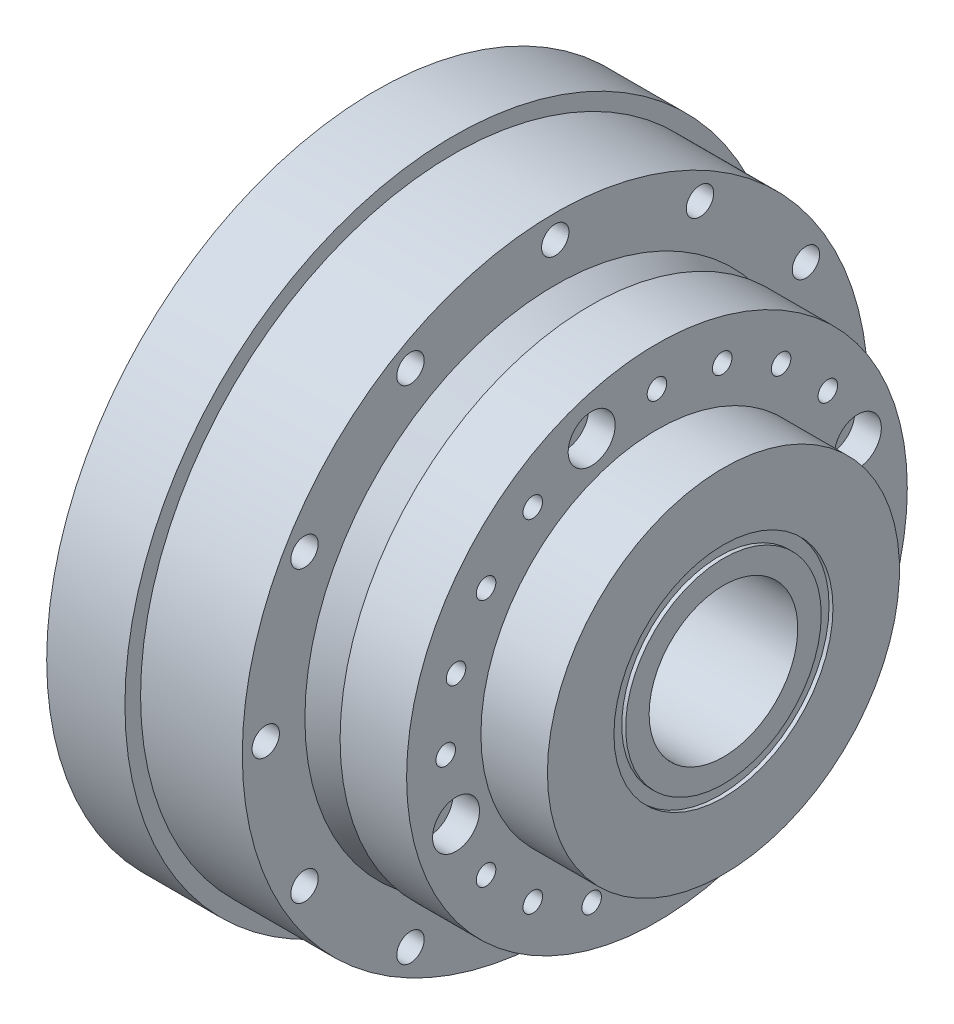
from build123d import *

# Parameters (mm, degrees)
CUT_EXTRUDE_1_REACH      = 76.218
SKETCH_5_R               = 1.75
PATTERN_CIRCULAR_2_COUNT = 12
SKETCH_9_R               = 22.5
SKETCH_9_R_2             = 10
EXTRUDE_1_DEPTH          = 5.5
PATTERN_CIRCULAR_4_COUNT = 3
SKETCH_12_R              = 14
SKETCH_12_R_2            = 12.5
CUT_EXTRUDE_4_DEPTH      = 0.5
CUT_EXTRUDE_START        = -0.5
SKETCH_14_R              = 14
SKETCH_14_R_2            = 12.5
CUT_EXTRUDE_5_DEPTH      = 0.5
PATTERN_CIRCULAR_5_COUNT = 4
PATTERN_CIRCULAR_5_ANGLE = 54
PATTERN_CIRCULAR_7_COUNT = 4


with BuildPart() as part:
    # 草图1 → 旋转1 (revolve)
    with BuildSketch(Plane.XY):
        Polygon((0, 9.5), (0, 12.5), (12, 12.5), (12, 42), (22, 42), (22, 40), (35, 40), (35, 32), (39.5, 29.401923789), (39.5, 32), (48, 32), (48, 22.5), (56.5, 22.5), (56.5, 9.5), align=None)
    revolve(axis=Axis((-65.200779727, 0, 0), (1, 0, 0)))

    # 草图5 → 切除-拉伸1 (cut, up to next)
    with BuildSketch(Plane.ZY.offset(-12), mode=Mode.PRIVATE) as cut_extrude_1_sk1:
        with Locations((0, 37)):
            Circle(SKETCH_5_R)
    cut_extrude_1_tool1 = extrude(cut_extrude_1_sk1.sketch, amount=-CUT_EXTRUDE_1_REACH, mode=Mode.PRIVATE) & part.part
    cut_extrude_1 = cut_extrude_1_tool1.solids().sort_by_distance((12, 37, 0))[0]
    add(cut_extrude_1, mode=Mode.SUBTRACT)

    # 阵列(圆周)2: 切除-拉伸1 ×12 about axis
    pattern_circular_2_axis = Axis((56.5, 0, 0), (-1, 0, 0))
    for i in range(1, PATTERN_CIRCULAR_2_COUNT):
        add(cut_extrude_1.rotate(pattern_circular_2_axis, i * 360 / PATTERN_CIRCULAR_2_COUNT), mode=Mode.SUBTRACT)

    # 草图9 → 凸台-拉伸1 (add)
    with BuildSketch(Plane.ZY.offset(-12)):
        Circle(SKETCH_9_R)
        Circle(SKETCH_9_R_2, mode=Mode.SUBTRACT)
    extrude(amount=EXTRUDE_1_DEPTH)

    # 草图10 → M3 螺纹孔3 (revolve, cut)
    with BuildSketch(Plane(origin=(2.5, 12.5, 0), x_dir=(0, 0, 1), z_dir=(1, 0, 0))):
        Polygon((0, 0), (0, 7.251075774), (1.25, 6.5), (1.25, 0), align=None)
    hole_wizard_m3_3 = revolve(axis=Axis((2.5, 18.85, 0), (0, -1, 0)), mode=Mode.SUBTRACT)

    # 阵列(圆周)4: M3 螺纹孔3 ×3 about axis
    pattern_circular_4_axis = Axis((56.5, 0, 0), (-1, 0, 0))
    for i in range(1, PATTERN_CIRCULAR_4_COUNT):
        add(hole_wizard_m3_3.rotate(pattern_circular_4_axis, i * 360 / PATTERN_CIRCULAR_4_COUNT), mode=Mode.SUBTRACT)

    # 草图12 → 切除-拉伸4 (cut)
    with BuildSketch(Plane(origin=(56.5, 0, 0), x_dir=(0, 0, -1), z_dir=(1, 0, 0))):
        Circle(SKETCH_12_R)
        Circle(SKETCH_12_R_2, mode=Mode.SUBTRACT)
    extrude(amount=-CUT_EXTRUDE_4_DEPTH, mode=Mode.SUBTRACT)

    # 草图14 → 切除-拉伸5 (cut)
    with BuildSketch(Plane.ZY.offset(-6.5).offset(CUT_EXTRUDE_START)):
        Circle(SKETCH_14_R)
        Circle(SKETCH_14_R_2, mode=Mode.SUBTRACT)
    extrude(amount=CUT_EXTRUDE_5_DEPTH, mode=Mode.SUBTRACT)

    # 草图15 → M3 螺纹孔4 (revolve, cut)
    with BuildSketch(Plane(origin=(48, 27, 0), x_dir=(0, 0, -1), z_dir=(0, 1, 0))):
        Polygon((0, 0), (0, 12.751075774), (1.25, 12), (1.25, 0), align=None)
    hole_wizard_m3_4 = revolve(axis=Axis((54.35, 27, 0), (-1, 0, 0)), mode=Mode.SUBTRACT)

    # 阵列(圆周)5: M3 螺纹孔4 ×4 about axis
    pattern_circular_5_axis = Axis((56.5, 0, 0), (-1, 0, 0))
    for i in range(1, PATTERN_CIRCULAR_5_COUNT):
        add(hole_wizard_m3_4.rotate(pattern_circular_5_axis, i * PATTERN_CIRCULAR_5_ANGLE / (PATTERN_CIRCULAR_5_COUNT - 1)), mode=Mode.SUBTRACT)

    # 阵列(圆周)6 copy 1 sketch → 阵列(圆周)6 copy 1 (revolve, cut)
    with BuildSketch(Plane(origin=(48, -8.343458848, -25.67852594), x_dir=(0, -0.9510565162951534, 0.309016994374948), z_dir=(0, -0.309016994374948, -0.9510565162951534))):
        Polygon((0, 0), (0, 12.751075774), (1.25, 12), (1.25, 0), align=None)
    revolve(axis=Axis((54.35, -8.343458848, -25.67852594), (-1, 0, 0)), mode=Mode.SUBTRACT)

    # 阵列(圆周)6 copy 2 sketch → 阵列(圆周)6 copy 2 (revolve, cut)
    with BuildSketch(Plane(origin=(48, -25.67852594, 8.343458848), x_dir=(0, 0.30901699437494795, 0.9510565162951534), z_dir=(0, -0.9510565162951534, 0.30901699437494795))):
        Polygon((0, 0), (0, 12.751075774), (1.25, 12), (1.25, 0), align=None)
    revolve(axis=Axis((54.35, -25.67852594, 8.343458848), (-1, 0, 0)), mode=Mode.SUBTRACT)

    # 阵列(圆周)6 copy 3 sketch → 阵列(圆周)6 copy 3 (revolve, cut)
    with BuildSketch(Plane(origin=(48, 8.343458848, 25.67852594), x_dir=(0, 0.9510565162951535, -0.3090169943749479), z_dir=(0, 0.3090169943749479, 0.9510565162951535))):
        Polygon((0, 0), (0, 12.751075774), (1.25, 12), (1.25, 0), align=None)
    revolve(axis=Axis((54.35, 8.343458848, 25.67852594), (-1, 0, 0)), mode=Mode.SUBTRACT)

    # 阵列(圆周)6 copy 4 sketch → 阵列(圆周)6 copy 4 (revolve, cut)
    with BuildSketch(Plane(origin=(48, -15.870201812, -21.843458848), x_dir=(0, -0.8090169943749467, 0.5877852522924741), z_dir=(0, -0.5877852522924741, -0.8090169943749467))):
        Polygon((0, 0), (0, 12.751075774), (1.25, 12), (1.25, 0), align=None)
    revolve(axis=Axis((54.35, -15.870201812, -21.843458848), (-1, 0, 0)), mode=Mode.SUBTRACT)

    # 阵列(圆周)6 copy 5 sketch → 阵列(圆周)6 copy 5 (revolve, cut)
    with BuildSketch(Plane(origin=(48, -21.843458848, 15.870201812), x_dir=(0, 0.587785252292474, 0.8090169943749468), z_dir=(0, -0.8090169943749468, 0.587785252292474))):
        Polygon((0, 0), (0, 12.751075774), (1.25, 12), (1.25, 0), align=None)
    revolve(axis=Axis((54.35, -21.843458848, 15.870201812), (-1, 0, 0)), mode=Mode.SUBTRACT)

    # 阵列(圆周)6 copy 6 sketch → 阵列(圆周)6 copy 6 (revolve, cut)
    with BuildSketch(Plane(origin=(48, 15.870201812, 21.843458848), x_dir=(0, 0.8090169943749468, -0.587785252292474), z_dir=(0, 0.587785252292474, 0.8090169943749468))):
        Polygon((0, 0), (0, 12.751075774), (1.25, 12), (1.25, 0), align=None)
    revolve(axis=Axis((54.35, 15.870201812, 21.843458848), (-1, 0, 0)), mode=Mode.SUBTRACT)

    # 阵列(圆周)6 copy 7 sketch → 阵列(圆周)6 copy 7 (revolve, cut)
    with BuildSketch(Plane(origin=(48, -21.843458848, -15.870201812), x_dir=(0, -0.5877852522924716, 0.8090169943749486), z_dir=(0, -0.8090169943749486, -0.5877852522924716))):
        Polygon((0, 0), (0, 12.751075774), (1.25, 12), (1.25, 0), align=None)
    revolve(axis=Axis((54.35, -21.843458848, -15.870201812), (-1, 0, 0)), mode=Mode.SUBTRACT)

    # 阵列(圆周)6 copy 8 sketch → 阵列(圆周)6 copy 8 (revolve, cut)
    with BuildSketch(Plane(origin=(48, -15.870201812, 21.843458848), x_dir=(0, 0.8090169943749485, 0.5877852522924717), z_dir=(0, -0.5877852522924717, 0.8090169943749485))):
        Polygon((0, 0), (0, 12.751075774), (1.25, 12), (1.25, 0), align=None)
    revolve(axis=Axis((54.35, -15.870201812, 21.843458848), (-1, 0, 0)), mode=Mode.SUBTRACT)

    # 阵列(圆周)6 copy 9 sketch → 阵列(圆周)6 copy 9 (revolve, cut)
    with BuildSketch(Plane(origin=(48, 21.843458848, 15.870201812), x_dir=(0, 0.5877852522924717, -0.8090169943749485), z_dir=(0, 0.8090169943749485, 0.5877852522924717))):
        Polygon((0, 0), (0, 12.751075774), (1.25, 12), (1.25, 0), align=None)
    revolve(axis=Axis((54.35, 21.843458848, 15.870201812), (-1, 0, 0)), mode=Mode.SUBTRACT)

    # 阵列(圆周)6 copy 10 sketch → 阵列(圆周)6 copy 10 (revolve, cut)
    with BuildSketch(Plane(origin=(48, 0, -27), x_dir=(0, -1, 0), z_dir=(0, 0, -1))):
        Polygon((0, 0), (0, 12.751075774), (1.25, 12), (1.25, 0), align=None)
    revolve(axis=Axis((54.35, 0, -27), (-1, 0, 0)), mode=Mode.SUBTRACT)

    # 阵列(圆周)6 copy 11 sketch → 阵列(圆周)6 copy 11 (revolve, cut)
    with BuildSketch(Plane(origin=(48, -27, 0), x_dir=(0, 0, 1), z_dir=(0, -1, 0))):
        Polygon((0, 0), (0, 12.751075774), (1.25, 12), (1.25, 0), align=None)
    revolve(axis=Axis((54.35, -27, 0), (-1, 0, 0)), mode=Mode.SUBTRACT)

    # 阵列(圆周)6 copy 12 sketch → 阵列(圆周)6 copy 12 (revolve, cut)
    with BuildSketch(Plane(origin=(48, 0, 27), x_dir=(0, 1, 0), z_dir=(0, 0, 1))):
        Polygon((0, 0), (0, 12.751075774), (1.25, 12), (1.25, 0), align=None)
    revolve(axis=Axis((54.35, 0, 27), (-1, 0, 0)), mode=Mode.SUBTRACT)

    # 草图17 → 打孔尺寸(%根据)内六角圆柱头螺钉的类型1 (revolve, cut)
    with BuildSketch(Plane(origin=(48, 25.67852594, 8.343458848), x_dir=(0, 0, -1), z_dir=(0, 1, 0))):
        Polygon((0, 0), (0, 16.521463052), (1.7, 15.5), (1.7, 3.4), (3, 3.4), (3, 0), align=None)
    hole_wizard_1 = revolve(axis=Axis((54.35, 25.67852594, 8.343458848), (-1, 0, 0)), mode=Mode.SUBTRACT)

    # 阵列(圆周)7: 打孔尺寸(%根据)内六角圆柱头螺钉的类型1 ×4 about axis
    pattern_circular_7_axis = Axis((56.5, 0, 0), (-1, 0, 0))
    for i in range(1, PATTERN_CIRCULAR_7_COUNT):
        add(hole_wizard_1.rotate(pattern_circular_7_axis, i * 360 / PATTERN_CIRCULAR_7_COUNT), mode=Mode.SUBTRACT)


solid = part.part
